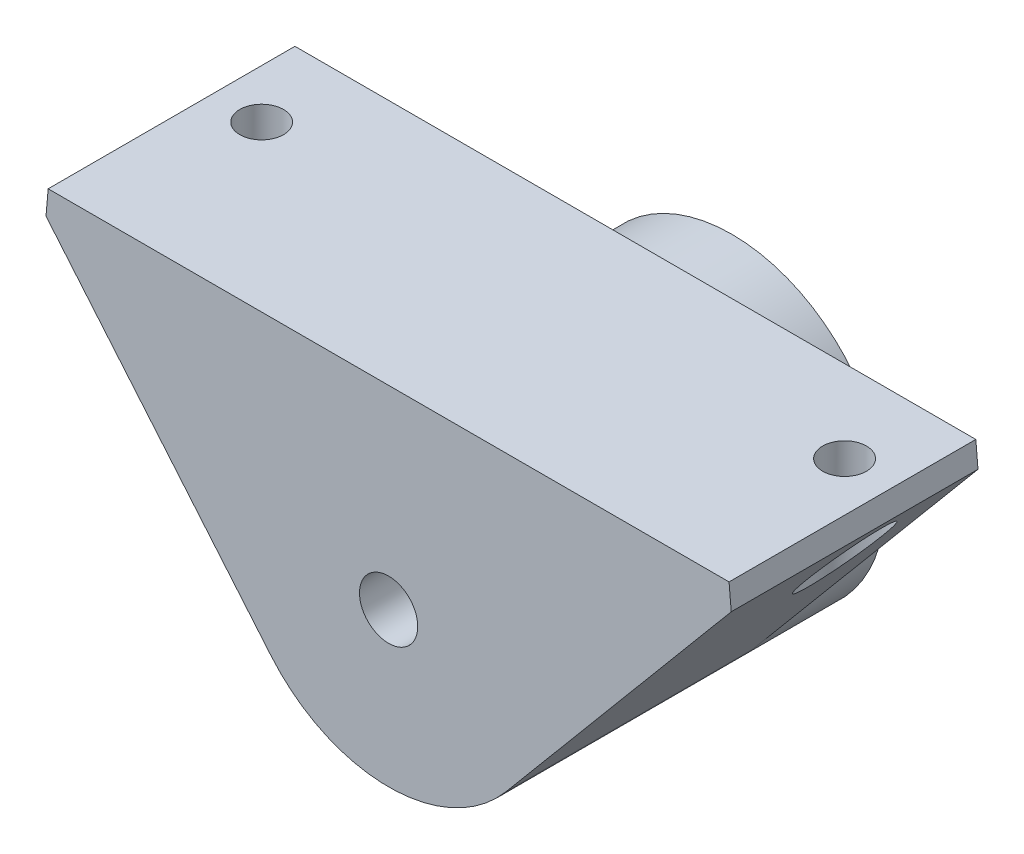
from build123d import *
from OCP.BRepFilletAPI import BRepFilletAPI_MakeChamfer

# Parameters (mm, degrees)
SKETCH1_R               = 23.7
SKETCH1_R_2             = 18.7
BOSS_EXTRUDE1_DEPTH     = 48
BOSS_EXTRUDE2_START     = 5
SKETCH1_3_R             = 23.7
SKETCH1_3_R_2           = 18.7
SKETCH1_3_R_3           = 15.5
SKETCH1_3_R_4           = 6.5
BOSS_EXTRUDE2_DEPTH     = 5
BOSS_EXTRUDE3_DEPTH     = 38.1
F_1_4_CLEARANCE_HOLE1_D = 6.7564
SKETCH9_R               = 5.715
CUT_EXTRUDE1_DEPTH      = 89.454226705
CHAMFER1_SIZE           = 5
CHAMFER1_SIZE2          = 3.549039071
SKETCH10_R              = 18.7
SKETCH10_R_2            = 4.5
BOSS_EXTRUDE4_DEPTH     = 48
SKETCH10_2_R            = 4.5
CUT_EXTRUDE2_DEPTH      = 78.473312523


with BuildPart() as part:
    # Sketch1 → Boss-Extrude1 (new body)
    with BuildSketch(Plane.XY):
        Circle(SKETCH1_R)
        Circle(SKETCH1_R_2, mode=Mode.SUBTRACT)
    extrude(amount=-BOSS_EXTRUDE1_DEPTH)

    # Sketch1<3> → Boss-Extrude2 (add)
    # profile 1 of 4: a face of its own
    with BuildSketch(Plane.XY.offset(BOSS_EXTRUDE2_START)):
        Circle(SKETCH1_3_R)
        Circle(SKETCH1_3_R_2, mode=Mode.SUBTRACT)
    # profile 2 of 4: a face of its own
    with BuildSketch(Plane.XY.offset(BOSS_EXTRUDE2_START)):
        Circle(SKETCH1_3_R_2)
        Circle(SKETCH1_3_R_3, mode=Mode.SUBTRACT)
    # profile 3 of 4: a face of its own
    with BuildSketch(Plane.XY.offset(BOSS_EXTRUDE2_START)):
        Circle(SKETCH1_3_R_3)
        with Locations((0, 7.5)):
            Circle(SKETCH1_3_R_4, mode=Mode.SUBTRACT)
    # profile 4 of 4: a face of its own
    with BuildSketch(Plane.XY.offset(BOSS_EXTRUDE2_START)):
        with Locations((0, 7.5)):
            Circle(SKETCH1_3_R_4)
    extrude(amount=-BOSS_EXTRUDE2_DEPTH)

    # Sketch5 → Boss-Extrude3 (add)
    with BuildSketch(Plane.XY.offset(5)):
        with BuildLine():
            Line((56.111141692, 30), (-56.111141692, 30))
            Line((-56.111141692, 30), (-18.155253302, -15.23406635))
            ThreePointArc((-18.155253302, -15.23406635), (-8.105877397, 22.270715113), (23.7, 0))
            ThreePointArc((23.7, 0), (22.270715113, -8.105877397), (18.155253302, -15.23406635))
            Line((18.155253302, -15.23406635), (56.111141692, 30))
        make_face()
    extrude(amount=-BOSS_EXTRUDE3_DEPTH)

    # 1/4 Clearance Hole1 (through all)
    with Locations(Plane(origin=(0, 30, 0), x_dir=(1, 0, 0), z_dir=(0, 1, 0))):
        with Locations((-45, 20.4), (45, 20.4)):
            Hole(F_1_4_CLEARANCE_HOLE1_D / 2)

    # Sketch9 → Cut-Extrude1 (cut, through all)
    with BuildSketch(Plane(origin=(0, 25, 0), x_dir=(1, 0, 0), z_dir=(0, 1, 0))):
        with Locations(Location((-45, 20.4, 0), (0, 0, 180))):
            Circle(SKETCH9_R)
        with Locations(Location((45, 20.4, 0), (0, 0, 180))):
            Circle(SKETCH9_R)
    extrude(amount=-CUT_EXTRUDE1_DEPTH, mode=Mode.SUBTRACT)

    # Chamfer1: one chamfer whose edges measure the first distance from different faces: ONE call of the kernel's chamfer builder (chamfer() names one face for all edges)
    chamfer1_edges_1 = [part.edges().sort_by_distance(p)[0] for p in [
        (56.111141692, 30, -14.05),
    ]]
    chamfer1_side_1 = [part.faces().sort_by_distance(p)[0] for p in [
        (36.532384477, 6.666945749, -13.565030067),
    ]]
    chamfer1_edges_2 = [part.edges().sort_by_distance(p)[0] for p in [
        (-56.111141692, 30, -14.05),
    ]]
    chamfer1_side_2 = [part.faces().sort_by_distance(p)[0] for p in [
        (-36.532384477, 6.666945749, -13.565030067),
    ]]
    chamfer1 = BRepFilletAPI_MakeChamfer(part.part.solid().wrapped)
    for e in chamfer1_edges_1:
        chamfer1.Add(CHAMFER1_SIZE, CHAMFER1_SIZE2, e.wrapped, chamfer1_side_1[0].wrapped)  # the first distance lies on this face
    for e in chamfer1_edges_2:
        chamfer1.Add(CHAMFER1_SIZE, CHAMFER1_SIZE2, e.wrapped, chamfer1_side_2[0].wrapped)  # the first distance lies on this face
    add(Compound.cast(chamfer1.Shape()), mode=Mode.REPLACE)

    # Sketch10 → Boss-Extrude4 (add)
    with BuildSketch(Plane(origin=(0, 0, 0), x_dir=(-1, 0, 0), z_dir=(0, 0, -1))):
        Circle(SKETCH10_R)
        with Locations(Location((0, 0, 0), (0, 0, 180))):
            Circle(SKETCH10_R_2, mode=Mode.SUBTRACT)
    extrude(amount=BOSS_EXTRUDE4_DEPTH)

    # Sketch10<2> → Cut-Extrude2 (cut, through all)
    with BuildSketch(Plane(origin=(0, 0, 0), x_dir=(-1, 0, 0), z_dir=(0, 0, -1))):
        with Locations(Location((0, 0, 0), (0, 0, 180))):
            Circle(SKETCH10_2_R)
    extrude(amount=-CUT_EXTRUDE2_DEPTH, mode=Mode.SUBTRACT)


solid = part.part
